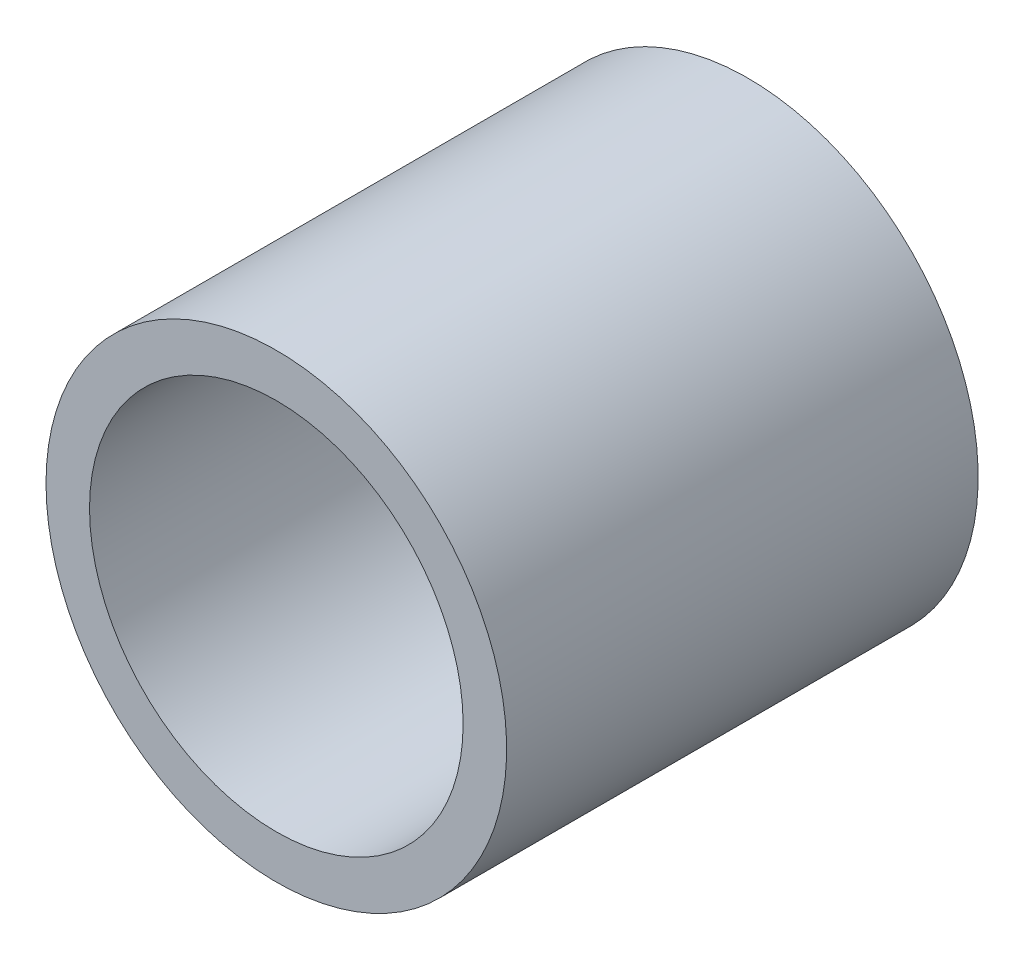
from build123d import *

# Parameters (mm, degrees)
ESBO_O1_R                = 6.35
ESBO_O1_R_2              = 5.15
RESSALTO_EXTRUS_O1_DEPTH = 13


with BuildPart() as part:
    # Esboço1 → Ressalto-extrusão1 (new body)
    with BuildSketch(Plane.XY):
        with Locations(Location((0, 0, 0), (0, 0, 180))):
            Circle(ESBO_O1_R)
        with Locations(Location((0, 0, 0), (0, 0, 180))):
            Circle(ESBO_O1_R_2, mode=Mode.SUBTRACT)
    extrude(amount=RESSALTO_EXTRUS_O1_DEPTH)


solid = part.part
